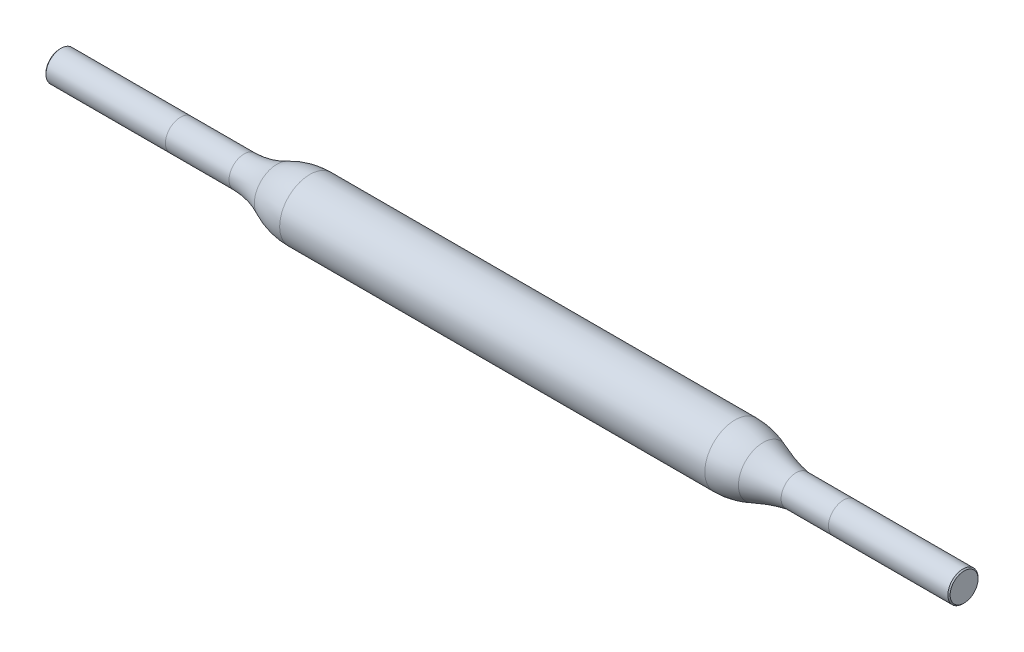
from build123d import *

# Parameters (mm, degrees)
CHAMFER1_SIZE = 0.075


with BuildPart() as part:
    # Sketch1 → Revolve1 (revolve)
    with BuildSketch(Plane.XY, mode=Mode.PRIVATE) as revolve1_sk:
        with BuildLine():
            Line((-31.12987988, 0), (28.87012012, 0))
            Line((28.87012012, 0), (28.87012012, 1))
            Line((28.87012012, 1), (17.727119622, 1))
            ThreePointArc((17.727119622, 1), (16.614949467, 1.263945716), (15.53469649, 1.637634487))
            ThreePointArc((15.53469649, 1.637634487), (14.617709468, 1.908572727), (13.665914437, 2))
            Line((13.665914437, 2), (-14.54810485, 2))
            ThreePointArc((-14.54810485, 2), (-15.666138839, 1.873397172), (-16.727554322, 1.5))
            ThreePointArc((-16.727554322, 1.5), (-17.788969805, 1.126602828), (-18.907003794, 1))
            Line((-18.907003794, 1), (-31.12987988, 1))
            Line((-31.12987988, 1), (-31.12987988, 0))
        make_face()
    revolve(revolve1_sk.sketch.rotate(Axis((-31.12987988, 0, 0), (1, 0, 0)), 90), axis=Axis((-31.12987988, 0, 0), (1, 0, 0)))

    # Chamfer1
    chamfer1_edges = [part.edges().sort_by_distance(p)[0] for p in [
        (28.87012012, 0, -1),
        (-31.12987988, 0, -1),
    ]]
    chamfer(chamfer1_edges, length=CHAMFER1_SIZE)


solid = part.part
